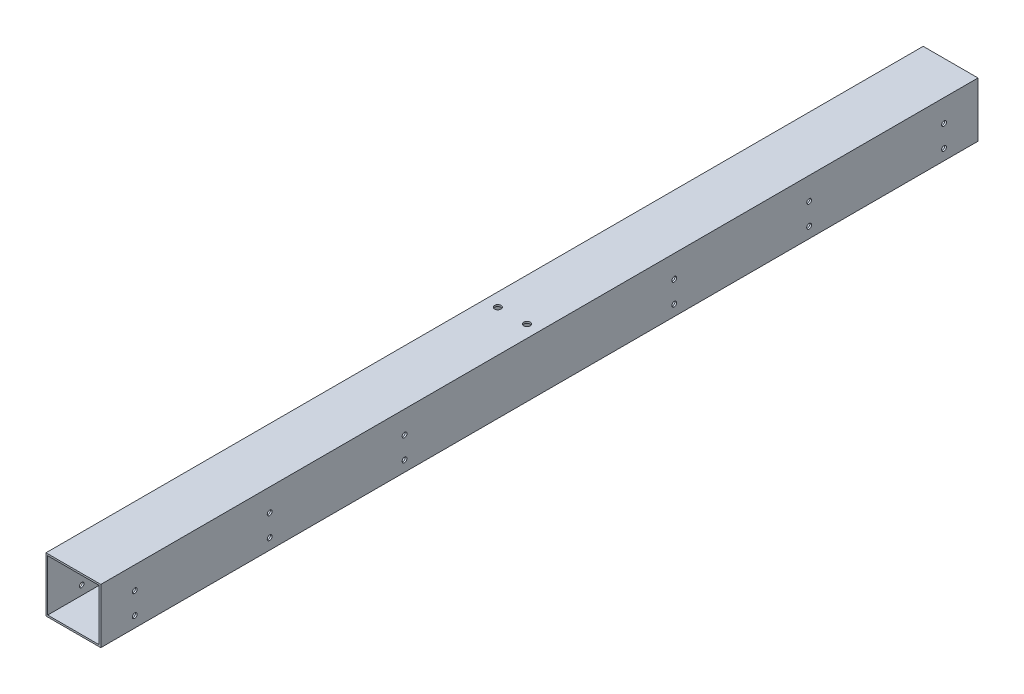
from build123d import *

# Parameters (mm, degrees)
SKETCH1_W                      = 101.6
SKETCH1_H                      = 101.6
SKETCH1_W_2                    = 95.25
SKETCH1_H_2                    = 95.25
EXTRUDE_THIN1_DEPTH            = 813
M8_CLEARANCE_HOLE2_D           = 8.4
M8_CLEARANCE_HOLE2_DEPTH       = 3.175
M8_CLEARANCE_HOLE1_D           = 9
M8_CLEARANCE_HOLE1_DEPTH       = 3.175
LPATTERN1_COUNT                = 7
LPATTERN1_PITCH                = 250
F_12_0_12_DIAMETER_HOLE1_D     = 12
F_12_0_12_DIAMETER_HOLE1_DEPTH = 3.175


with BuildPart() as part:
    # Sketch1 → Extrude-Thin1 (new, symmetric)
    with BuildSketch(Plane.XY):
        Rectangle(SKETCH1_W, SKETCH1_H)
        Rectangle(SKETCH1_W_2, SKETCH1_H_2, mode=Mode.SUBTRACT)
    extrude(amount=EXTRUDE_THIN1_DEPTH, both=True)

    # M8 Clearance Hole2
    with Locations(Plane.ZY.offset(50.8)):
        with Locations((750, 9.2), (750, -30.8)):
            m8_clearance_hole2 = Hole(M8_CLEARANCE_HOLE2_D / 2, depth=M8_CLEARANCE_HOLE2_DEPTH)

    # M8 Clearance Hole1
    with Locations(Plane.ZY.offset(-47.625)):
        with Locations((750, 9.2), (750, -30.8)):
            m8_clearance_hole1 = Hole(M8_CLEARANCE_HOLE1_D / 2, depth=M8_CLEARANCE_HOLE1_DEPTH)

    # LPattern1: M8 Clearance Hole2, M8 Clearance Hole1 ×7, 1 skipped
    with Locations(*[(0, 0, -i * LPATTERN1_PITCH) for i in range(1, LPATTERN1_COUNT) if i not in (3,)]):
        add(m8_clearance_hole2, mode=Mode.SUBTRACT)
        add(m8_clearance_hole1, mode=Mode.SUBTRACT)

    # Ø12.0 (12) Diameter Hole1
    with Locations(Plane(origin=(0, 50.8, 0), x_dir=(1, 0, 0), z_dir=(0, 1, 0))):
        with Locations((-26.2, 0), (27.8, 0)):
            Hole(F_12_0_12_DIAMETER_HOLE1_D / 2, depth=F_12_0_12_DIAMETER_HOLE1_DEPTH)


solid = part.part
